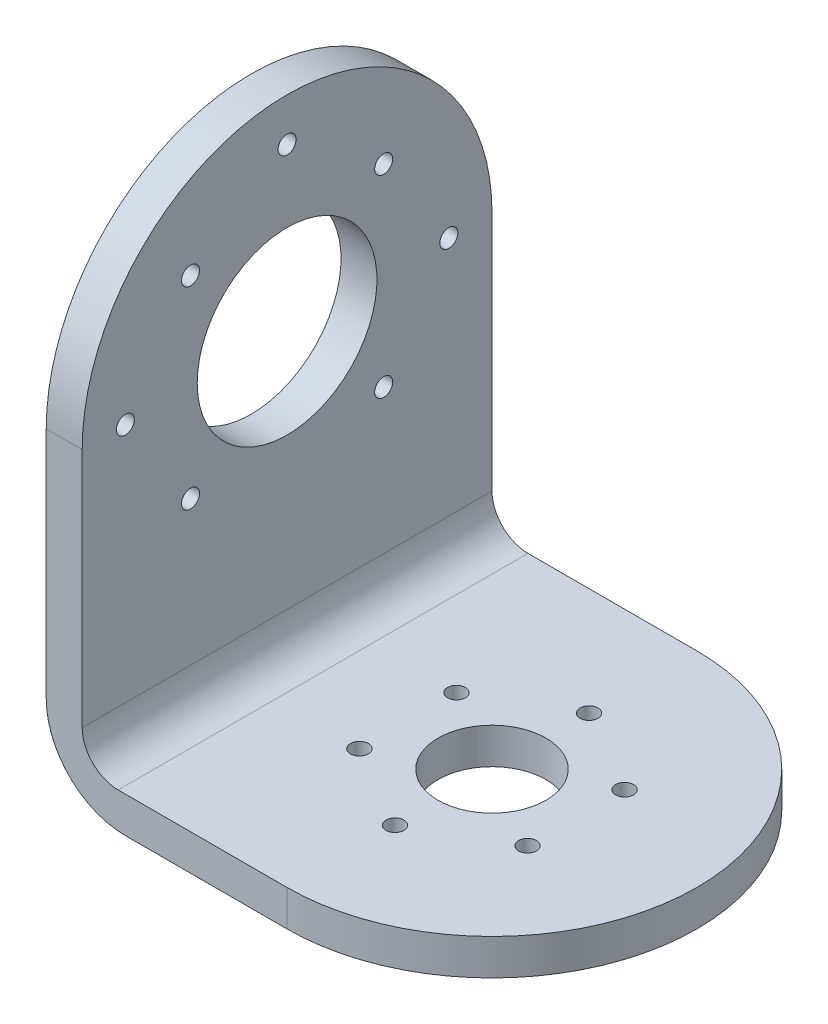
from build123d import *

# Parameters (mm, degrees)
EXTRUDE_1_DEPTH          = 57
CUT_EXTRUDE_1_DEPTH      = 57
CUT_EXTRUDE_2_DEPTH      = 57
FILLET_3_R               = 11
FILLET_4_R               = 5
SKETCH_4_R               = 12.5
SKETCH_4_R_2             = 1.25
CUT_EXTRUDE_3_DEPTH      = 57
PATTERN_CIRCULAR_1_COUNT = 4
SKETCH_5_R               = 1.25
CUT_EXTRUDE_4_DEPTH      = 57
PATTERN_CIRCULAR_2_COUNT = 3
PATTERN_CIRCULAR_2_ANGLE = 180
SKETCH_8_R               = 7.5
SKETCH_8_R_2             = 1.25
CUT_EXTRUDE_6_DEPTH      = 57
PATTERN_CIRCULAR_3_COUNT = 6


with BuildPart() as part:
    # 草图1 → 凸台-拉伸1 (new body)
    with BuildSketch(Plane.XY):
        Polygon((0, 0), (0, 72), (5, 72), (5, 5), (62, 5), (62, 0), align=None)
    extrude(amount=EXTRUDE_1_DEPTH)

    # 草图2 → 切除-拉伸1 (cut)
    with BuildSketch(Plane.ZY):
        with BuildLine():
            Line((57, 43.5), (57, 72))
            Line((57, 72), (28.5, 72))
            ThreePointArc((28.5, 72), (48.652543264, 63.652543264), (57, 43.5))
        make_face()
        with BuildLine():
            ThreePointArc((0, 43.5), (8.347456736, 63.652543264), (28.5, 72))
            Line((28.5, 72), (0, 72))
            Line((0, 72), (0, 43.5))
        make_face()
    extrude(amount=-CUT_EXTRUDE_1_DEPTH, mode=Mode.SUBTRACT)

    # 草图3 → 切除-拉伸2 (cut)
    with BuildSketch(Plane.XZ):
        with BuildLine():
            Line((62, 57), (33.5, 57))
            ThreePointArc((33.5, 57), (53.652543264, 48.652543264), (62, 28.5))
            Line((62, 28.5), (62, 57))
        make_face()
        with BuildLine():
            ThreePointArc((62, 28.5), (53.652543264, 8.347456736), (33.5, 0))
            Line((33.5, 0), (62, 0))
            Line((62, 0), (62, 28.5))
        make_face()
    extrude(amount=-CUT_EXTRUDE_2_DEPTH, mode=Mode.SUBTRACT)

    # 圆角3
    fillet_3_edges = [part.edges().sort_by_distance(p)[0] for p in [
        (0, 0, 28.5),
    ]]
    fillet(fillet_3_edges, radius=FILLET_3_R)

    # 圆角4
    fillet_4_edges = [part.edges().sort_by_distance(p)[0] for p in [
        (5, 5, 28.5),
    ]]
    fillet(fillet_4_edges, radius=FILLET_4_R)

    # 草图4 → 切除-拉伸3 (cut)
    with BuildSketch(Plane.ZY):
        with Locations((28.5, 43.5)):
            Circle(SKETCH_4_R)
        with Locations((41.935028843, 56.935028843)):
            Circle(SKETCH_4_R_2)
    cut_extrude_3 = extrude(amount=-CUT_EXTRUDE_3_DEPTH, mode=Mode.SUBTRACT)

    # 阵列(圆周)1: 切除-拉伸3 ×4 about axis
    pattern_circular_1_axis = Axis((0, 43.5, 28.5), (1, 0, 0))
    for i in range(1, PATTERN_CIRCULAR_1_COUNT):
        add(cut_extrude_3.rotate(pattern_circular_1_axis, i * 360 / PATTERN_CIRCULAR_1_COUNT), mode=Mode.SUBTRACT)

    # 草图5 → 切除-拉伸4 (cut)
    with BuildSketch(Plane.ZY):
        with Locations((51, 43.5)):
            Circle(SKETCH_5_R)
    cut_extrude_4 = extrude(amount=-CUT_EXTRUDE_4_DEPTH, mode=Mode.SUBTRACT)

    # 阵列(圆周)2: 切除-拉伸4 ×3 about axis
    pattern_circular_2_axis = Axis((0, 43.5, 28.5), (-1, 0, 0))
    for i in range(1, PATTERN_CIRCULAR_2_COUNT):
        add(cut_extrude_4.rotate(pattern_circular_2_axis, i * PATTERN_CIRCULAR_2_ANGLE / (PATTERN_CIRCULAR_2_COUNT - 1)), mode=Mode.SUBTRACT)

    # 草图8 → 切除-拉伸6 (cut)
    with BuildSketch(Plane.XZ):
        with Locations((33.5, 28.5)):
            Circle(SKETCH_8_R)
        with Locations((33.5, 15)):
            Circle(SKETCH_8_R_2)
    cut_extrude_6 = extrude(amount=-CUT_EXTRUDE_6_DEPTH, mode=Mode.SUBTRACT)

    # 阵列(圆周)3: 切除-拉伸6 ×6 about axis
    pattern_circular_3_axis = Axis((33.5, 0, 28.5), (0, 1, 0))
    for i in range(1, PATTERN_CIRCULAR_3_COUNT):
        add(cut_extrude_6.rotate(pattern_circular_3_axis, i * 360 / PATTERN_CIRCULAR_3_COUNT), mode=Mode.SUBTRACT)


solid = part.part
